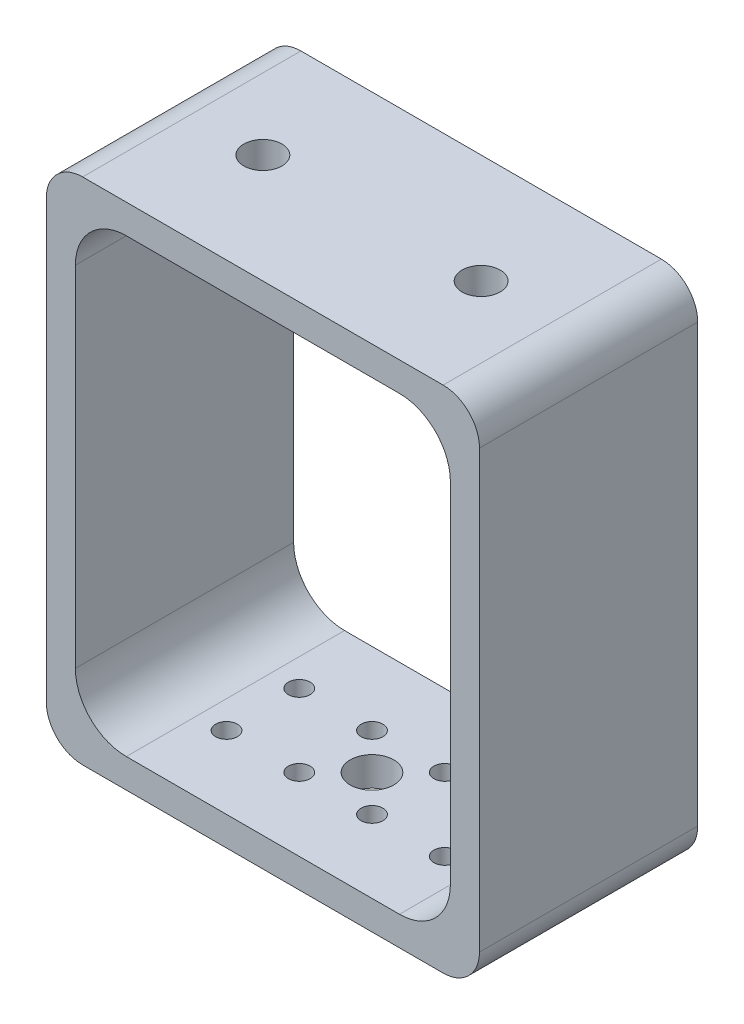
from build123d import *

# Parameters (mm, degrees)
EXTRUDE_2_DEPTH     = 15
SKETCH_2_R          = 2.62067407
CUT_EXTRUDE_1_DEPTH = 74.942500428
FILLET_1_R          = 7
CUT_EXTRUDE_2_REACH = 79.534
SKETCH_3_R          = 3
SKETCH_3_R_2        = 1.5
FILLET_2_R          = 5


with BuildPart() as part:
    # 草图1 → 拉伸-薄壁2 (new, symmetric)
    with BuildSketch(Plane.XY):
        Polygon((-29.774038515, 0), (29.774038515, 0), (29.774038515, 70), (0, 70), (-29.774038515, 70), align=None)
        Polygon((-25.774038515, 4), (25.774038515, 4), (25.774038515, 66), (0, 66), (-25.774038515, 66), align=None, mode=Mode.SUBTRACT)
    extrude(amount=EXTRUDE_2_DEPTH, both=True)

    # 草图2 → 切除-拉伸1 (cut, through all)
    with BuildSketch(Plane(origin=(0, 66, 0), x_dir=(-1, 0, 0), z_dir=(0, -1, 0))):
        with Locations(Location((-15, 0, 0), (0, 0, 90))):
            Circle(SKETCH_2_R)
        with Locations(Location((15, 0, 0), (0, 0, 90))):
            Circle(SKETCH_2_R)
    extrude(amount=-CUT_EXTRUDE_1_DEPTH, mode=Mode.SUBTRACT)

    # 圆角1
    fillet_1_edges = [part.edges().sort_by_distance(p)[0] for p in [
        (-25.774038515, 4, 0),
        (25.774038515, 4, 0),
        (25.774038515, 66, 0),
        (-25.774038515, 66, 0),
    ]]
    fillet(fillet_1_edges, radius=FILLET_1_R)

    # 草图3 → 切除-拉伸2 (cut, up to next)
    with BuildSketch(Plane(origin=(0, 0, 0), x_dir=(1, 0, 0), z_dir=(0, 1, 0)), mode=Mode.PRIVATE) as cut_extrude_2_sk1:
        with Locations(Location((0, 0, 0), (0, 0, 180))):
            Circle(SKETCH_3_R)
    cut_extrude_2_tool1 = extrude(cut_extrude_2_sk1.sketch, amount=CUT_EXTRUDE_2_REACH, mode=Mode.PRIVATE) & part.part
    # 草图3 → 切除-拉伸2 (cut, up to next)
    with BuildSketch(Plane(origin=(0, 0, 0), x_dir=(1, 0, 0), z_dir=(0, 1, 0)), mode=Mode.PRIVATE) as cut_extrude_2_sk2:
        with Locations(Location((-15, 5, 0), (0, 0, 180))):
            Circle(SKETCH_3_R_2)
    cut_extrude_2_tool2 = extrude(cut_extrude_2_sk2.sketch, amount=CUT_EXTRUDE_2_REACH, mode=Mode.PRIVATE) & part.part
    # 草图3 → 切除-拉伸2 (cut, up to next)
    with BuildSketch(Plane(origin=(0, 0, 0), x_dir=(1, 0, 0), z_dir=(0, 1, 0)), mode=Mode.PRIVATE) as cut_extrude_2_sk3:
        with Locations(Location((-5, 5, 0), (0, 0, 180))):
            Circle(SKETCH_3_R_2)
    cut_extrude_2_tool3 = extrude(cut_extrude_2_sk3.sketch, amount=CUT_EXTRUDE_2_REACH, mode=Mode.PRIVATE) & part.part
    # 草图3 → 切除-拉伸2 (cut, up to next)
    with BuildSketch(Plane(origin=(0, 0, 0), x_dir=(1, 0, 0), z_dir=(0, 1, 0)), mode=Mode.PRIVATE) as cut_extrude_2_sk4:
        with Locations(Location((5, 5, 0), (0, 0, 180))):
            Circle(SKETCH_3_R_2)
    cut_extrude_2_tool4 = extrude(cut_extrude_2_sk4.sketch, amount=CUT_EXTRUDE_2_REACH, mode=Mode.PRIVATE) & part.part
    # 草图3 → 切除-拉伸2 (cut, up to next)
    with BuildSketch(Plane(origin=(0, 0, 0), x_dir=(1, 0, 0), z_dir=(0, 1, 0)), mode=Mode.PRIVATE) as cut_extrude_2_sk5:
        with Locations(Location((15, 5, 0), (0, 0, 180))):
            Circle(SKETCH_3_R_2)
    cut_extrude_2_tool5 = extrude(cut_extrude_2_sk5.sketch, amount=CUT_EXTRUDE_2_REACH, mode=Mode.PRIVATE) & part.part
    # 草图3 → 切除-拉伸2 (cut, up to next)
    with BuildSketch(Plane(origin=(0, 0, 0), x_dir=(1, 0, 0), z_dir=(0, 1, 0)), mode=Mode.PRIVATE) as cut_extrude_2_sk6:
        with Locations(Location((-5, -5, 0), (0, 0, 180))):
            Circle(SKETCH_3_R_2)
    cut_extrude_2_tool6 = extrude(cut_extrude_2_sk6.sketch, amount=CUT_EXTRUDE_2_REACH, mode=Mode.PRIVATE) & part.part
    # 草图3 → 切除-拉伸2 (cut, up to next)
    with BuildSketch(Plane(origin=(0, 0, 0), x_dir=(1, 0, 0), z_dir=(0, 1, 0)), mode=Mode.PRIVATE) as cut_extrude_2_sk7:
        with Locations(Location((5, -5, 0), (0, 0, 180))):
            Circle(SKETCH_3_R_2)
    cut_extrude_2_tool7 = extrude(cut_extrude_2_sk7.sketch, amount=CUT_EXTRUDE_2_REACH, mode=Mode.PRIVATE) & part.part
    # 草图3 → 切除-拉伸2 (cut, up to next)
    with BuildSketch(Plane(origin=(0, 0, 0), x_dir=(1, 0, 0), z_dir=(0, 1, 0)), mode=Mode.PRIVATE) as cut_extrude_2_sk8:
        with Locations(Location((15, -5, 0), (0, 0, 180))):
            Circle(SKETCH_3_R_2)
    cut_extrude_2_tool8 = extrude(cut_extrude_2_sk8.sketch, amount=CUT_EXTRUDE_2_REACH, mode=Mode.PRIVATE) & part.part
    # 草图3 → 切除-拉伸2 (cut, up to next)
    with BuildSketch(Plane(origin=(0, 0, 0), x_dir=(1, 0, 0), z_dir=(0, 1, 0)), mode=Mode.PRIVATE) as cut_extrude_2_sk9:
        with Locations(Location((-15, -5, 0), (0, 0, 180))):
            Circle(SKETCH_3_R_2)
    cut_extrude_2_tool9 = extrude(cut_extrude_2_sk9.sketch, amount=CUT_EXTRUDE_2_REACH, mode=Mode.PRIVATE) & part.part
    add(cut_extrude_2_tool1.solids().sort_by_distance((0, 0, 0))[0], mode=Mode.SUBTRACT)
    add(cut_extrude_2_tool2.solids().sort_by_distance((-15, 0, -5))[0], mode=Mode.SUBTRACT)
    add(cut_extrude_2_tool3.solids().sort_by_distance((-5, 0, -5))[0], mode=Mode.SUBTRACT)
    add(cut_extrude_2_tool4.solids().sort_by_distance((5, 0, -5))[0], mode=Mode.SUBTRACT)
    add(cut_extrude_2_tool5.solids().sort_by_distance((15, 0, -5))[0], mode=Mode.SUBTRACT)
    add(cut_extrude_2_tool6.solids().sort_by_distance((-5, 0, 5))[0], mode=Mode.SUBTRACT)
    add(cut_extrude_2_tool7.solids().sort_by_distance((5, 0, 5))[0], mode=Mode.SUBTRACT)
    add(cut_extrude_2_tool8.solids().sort_by_distance((15, 0, 5))[0], mode=Mode.SUBTRACT)
    add(cut_extrude_2_tool9.solids().sort_by_distance((-15, 0, 5))[0], mode=Mode.SUBTRACT)

    # 圆角2
    fillet_2_edges = [part.edges().sort_by_distance(p)[0] for p in [
        (-29.774038515, 0, 0),
        (-29.774038515, 70, 0),
        (29.774038515, 70, 0),
        (29.774038515, 0, 0),
    ]]
    fillet(fillet_2_edges, radius=FILLET_2_R)


solid = part.part
